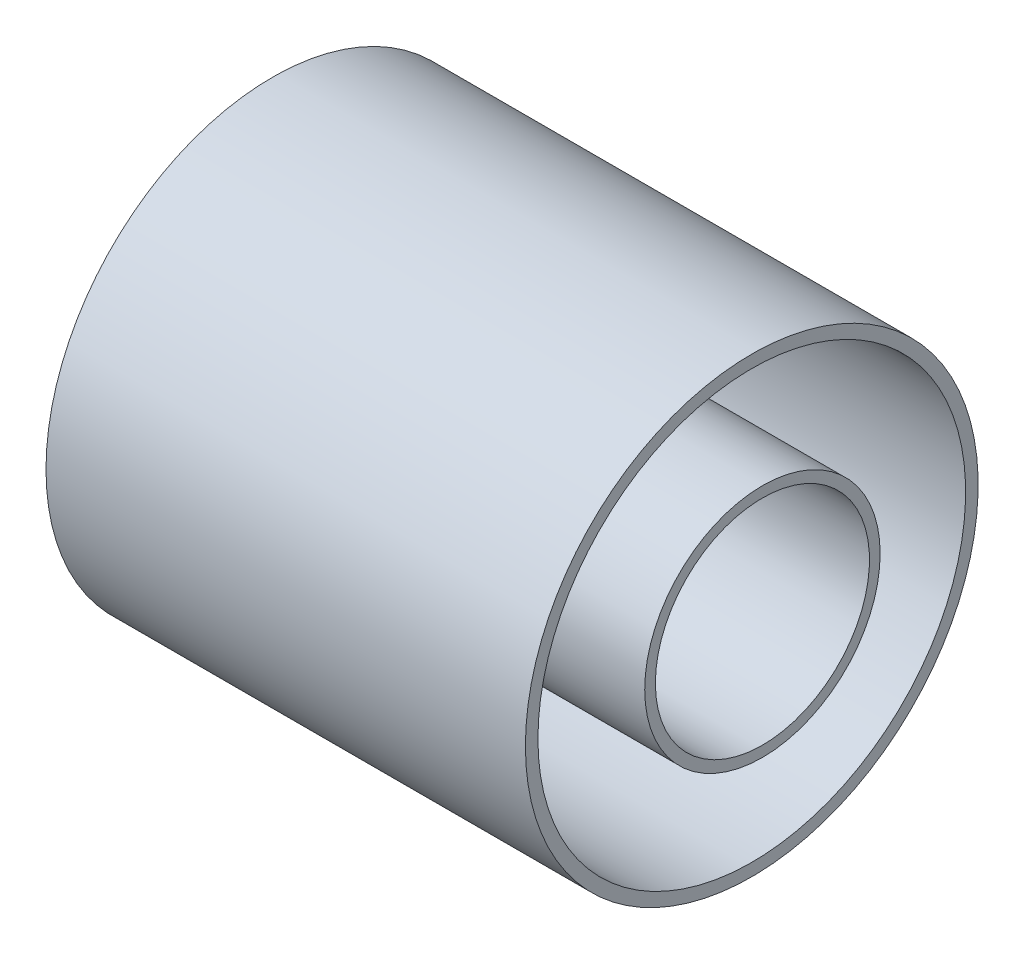
from build123d import *

# Parameters (mm, degrees)
SKETCH2_W   = 121.8692
SKETCH2_H   = 2.54
SKETCH2_W_2 = 114.3
SKETCH2_H_2 = 2.9845


with BuildPart() as part:
    # Sketch2 → Revolve1 (revolve)
    with BuildSketch(Plane.XY, mode=Mode.PRIVATE) as revolve1_sk:
        with Locations((3.023472735, 26.797)):
            Rectangle(SKETCH2_W, SKETCH2_H)
        with Locations((4.268072735, 52.48275)):
            Rectangle(SKETCH2_W_2, SKETCH2_H_2)
    revolve(revolve1_sk.sketch.rotate(Axis((0, 0, 0), (1, 0, 0)), 90), axis=Axis((0, 0, 0), (1, 0, 0)))


solid = part.part
